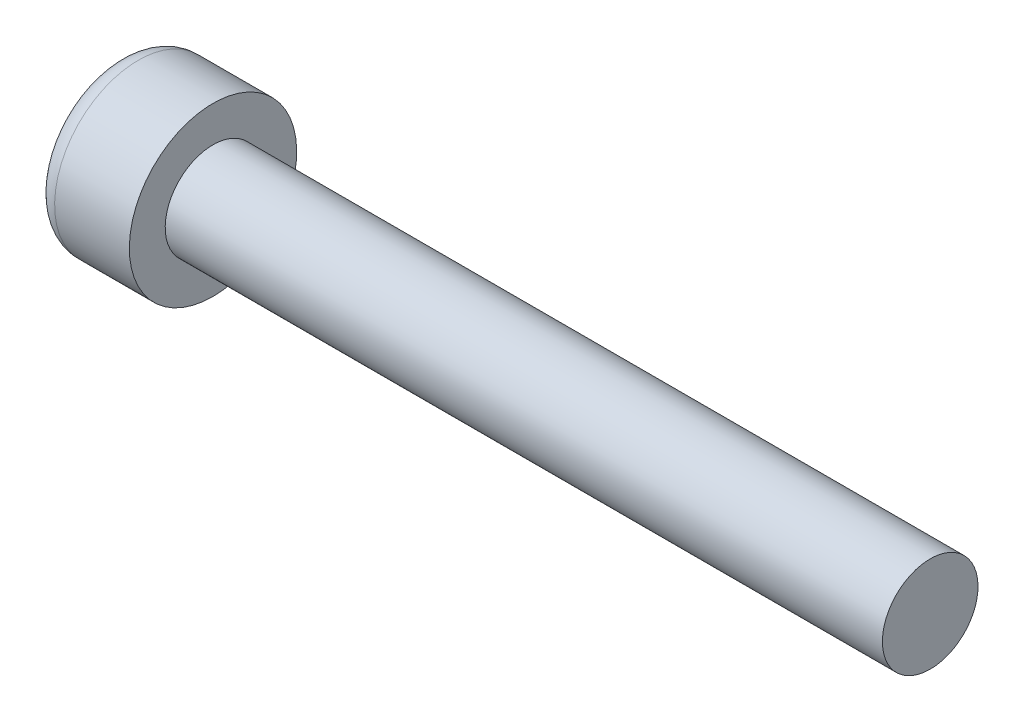
from build123d import *

# Parameters (mm, degrees)
CUT_EXTRUDE1_DEPTH = 2


with BuildPart() as part:
    # Sketch1 → Revolve1 (revolve)
    with BuildSketch(Plane.XY, mode=Mode.PRIVATE) as revolve1_sk:
        with BuildLine():
            Line((0, 0), (0, 2.625))
            ThreePointArc((0, 2.625), (0.256281566, 3.243718434), (0.875, 3.5))
            Line((0.875, 3.5), (4, 3.5))
            Line((4, 3.5), (4, 2))
            Line((4, 2), (34, 2))
            Line((34, 2), (34, 0))
            Line((34, 0), (0, 0))
        make_face()
    revolve(revolve1_sk.sketch.rotate(Axis((0, 0, 0), (1, 0, 0)), 180), axis=Axis((0, 0, 0), (1, 0, 0)))

    # Sketch2 → Cut-Extrude1 (cut)
    with BuildSketch(Plane.ZY):
        Polygon((0, 1.732050808), (-1.5, 0.866025404), (-1.5, -0.866025404), (0, -1.732050808), (1.5, -0.866025404), (1.5, 0.866025404), align=None)
    extrude(amount=-CUT_EXTRUDE1_DEPTH, mode=Mode.SUBTRACT)


solid = part.part
